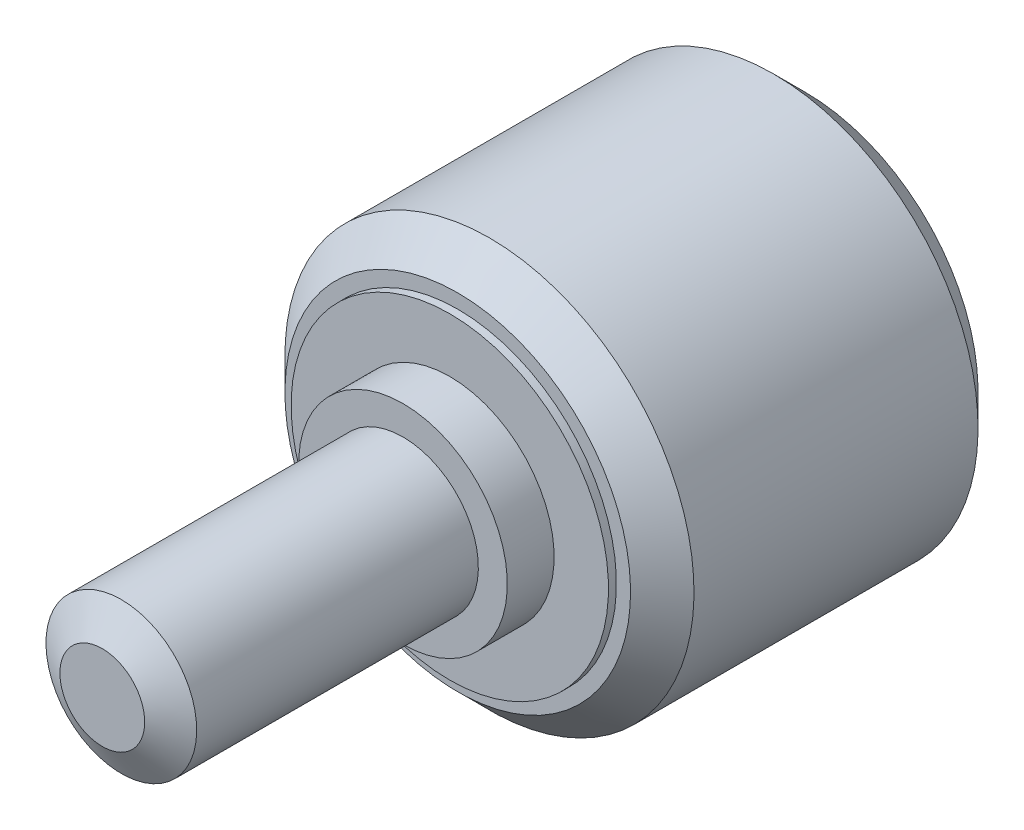
from build123d import *


with BuildPart() as part:
    # Sketch1 → Revolve1 (revolve)
    with BuildSketch(Plane(origin=(0, 0, 0), x_dir=(0, 0, -1), z_dir=(1, 0, 0))):
        Polygon((-1.4986, 2.413), (-1.4986, 3.3401), (0, 3.3401), (0, 5.08), (0.254, 5.08), (0.254, 5.5324375), (1.27, 6.5484375), (10.3632, 6.5484375), (11.3792, 5.5324375), (11.3792, 0), (-11.1252, 0), (-11.1252, 1.357141828), (-10.5156, 2.413), align=None)
    revolve(axis=Axis((0, 0, 11.1252), (0, 0, 1)))


solid = part.part
